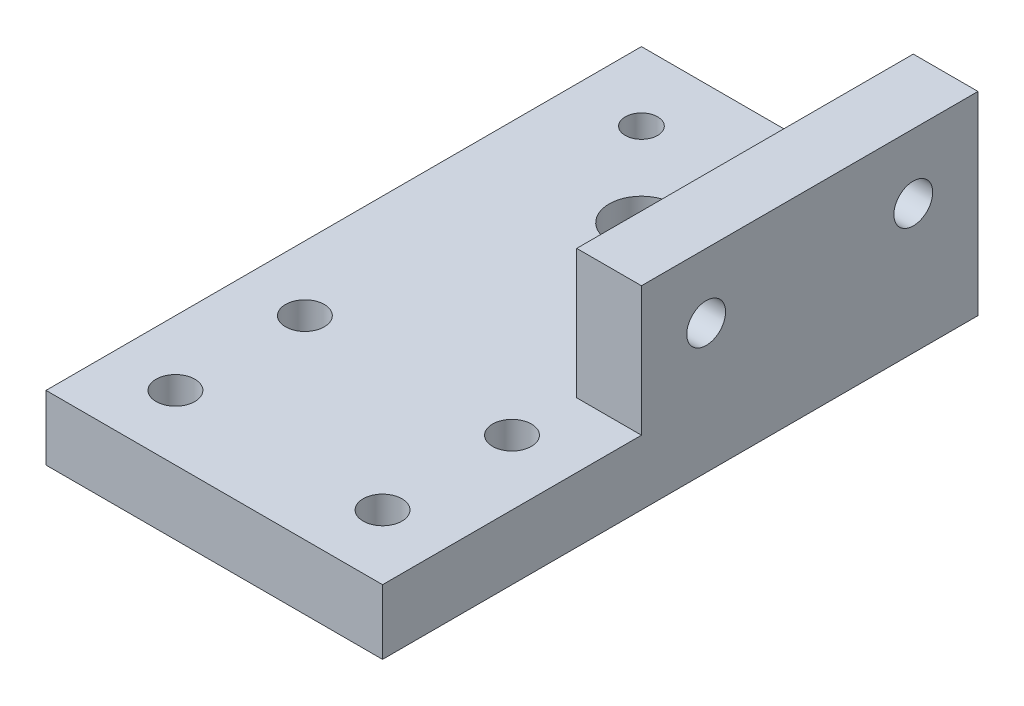
from build123d import *

# Parameters (mm, degrees)
SKETCH1_W           = 52
SKETCH1_H           = 92
BOSS_EXTRUDE1_DEPTH = 10
SKETCH2_W           = 10
SKETCH2_H           = 52
BOSS_EXTRUDE3_DEPTH = 20
CUT_EXTRUDE3_REACH  = 109.555
SKETCH5_R           = 3
SKETCH5_R_2         = 5
SKETCH5_R_3         = 2.5
CUT_EXTRUDE4_REACH  = 107.489
SKETCH6_R           = 3


with BuildPart() as part:
    # Sketch1 → Boss-Extrude1 (new body)
    with BuildSketch(Plane(origin=(0, 0, 0), x_dir=(1, 0, 0), z_dir=(0, 1, 0))):
        with Locations((26, 46)):
            Rectangle(SKETCH1_W, SKETCH1_H)
    extrude(amount=BOSS_EXTRUDE1_DEPTH)

    # Sketch2 → Boss-Extrude3 (add)
    with BuildSketch(Plane(origin=(0, 10, 0), x_dir=(1, 0, 0), z_dir=(0, 1, 0))):
        with Locations((47, 66)):
            Rectangle(SKETCH2_W, SKETCH2_H)
    extrude(amount=BOSS_EXTRUDE3_DEPTH)

    # Sketch5 → Cut-Extrude3 (cut, up to next)
    with BuildSketch(Plane(origin=(0, 10, 0), x_dir=(1, 0, 0), z_dir=(0, 1, 0)), mode=Mode.PRIVATE) as cut_extrude3_sk1:
        with Locations(Location((10, 30, 0), (0, 0, 270))):
            Circle(SKETCH5_R)
    cut_extrude3_tool1 = extrude(cut_extrude3_sk1.sketch, amount=-CUT_EXTRUDE3_REACH, mode=Mode.PRIVATE) & part.part
    # Sketch5 → Cut-Extrude3 (cut, up to next)
    with BuildSketch(Plane(origin=(0, 10, 0), x_dir=(1, 0, 0), z_dir=(0, 1, 0)), mode=Mode.PRIVATE) as cut_extrude3_sk2:
        with Locations(Location((42, 30, 0), (0, 0, 270))):
            Circle(SKETCH5_R)
    cut_extrude3_tool2 = extrude(cut_extrude3_sk2.sketch, amount=-CUT_EXTRUDE3_REACH, mode=Mode.PRIVATE) & part.part
    # Sketch5 → Cut-Extrude3 (cut, up to next)
    with BuildSketch(Plane(origin=(0, 10, 0), x_dir=(1, 0, 0), z_dir=(0, 1, 0)), mode=Mode.PRIVATE) as cut_extrude3_sk3:
        with Locations(Location((10, 10, 0), (0, 0, 270))):
            Circle(SKETCH5_R)
    cut_extrude3_tool3 = extrude(cut_extrude3_sk3.sketch, amount=-CUT_EXTRUDE3_REACH, mode=Mode.PRIVATE) & part.part
    # Sketch5 → Cut-Extrude3 (cut, up to next)
    with BuildSketch(Plane(origin=(0, 10, 0), x_dir=(1, 0, 0), z_dir=(0, 1, 0)), mode=Mode.PRIVATE) as cut_extrude3_sk4:
        with Locations(Location((42, 10, 0), (0, 0, 270))):
            Circle(SKETCH5_R)
    cut_extrude3_tool4 = extrude(cut_extrude3_sk4.sketch, amount=-CUT_EXTRUDE3_REACH, mode=Mode.PRIVATE) & part.part
    # Sketch5 → Cut-Extrude3 (cut, up to next)
    with BuildSketch(Plane(origin=(0, 10, 0), x_dir=(1, 0, 0), z_dir=(0, 1, 0)), mode=Mode.PRIVATE) as cut_extrude3_sk5:
        with Locations(Location((23.55, 68.45, 0), (0, 0, 270))):
            Circle(SKETCH5_R_2)
    cut_extrude3_tool5 = extrude(cut_extrude3_sk5.sketch, amount=-CUT_EXTRUDE3_REACH, mode=Mode.PRIVATE) & part.part
    # Sketch5 → Cut-Extrude3 (cut, up to next)
    with BuildSketch(Plane(origin=(0, 10, 0), x_dir=(1, 0, 0), z_dir=(0, 1, 0)), mode=Mode.PRIVATE) as cut_extrude3_sk6:
        with Locations(Location((10.645301243, 81.354698757, 0), (0, 0, 270))):
            Circle(SKETCH5_R_3)
    cut_extrude3_tool6 = extrude(cut_extrude3_sk6.sketch, amount=-CUT_EXTRUDE3_REACH, mode=Mode.PRIVATE) & part.part
    # Sketch5 → Cut-Extrude3 (cut, up to next)
    with BuildSketch(Plane(origin=(0, 10, 0), x_dir=(1, 0, 0), z_dir=(0, 1, 0)), mode=Mode.PRIVATE) as cut_extrude3_sk7:
        with Locations(Location((36.454698757, 55.545301243, 0), (0, 0, 270))):
            Circle(SKETCH5_R_3)
    cut_extrude3_tool7 = extrude(cut_extrude3_sk7.sketch, amount=-CUT_EXTRUDE3_REACH, mode=Mode.PRIVATE) & part.part
    add(cut_extrude3_tool1.solids().sort_by_distance((10, 10, -30))[0], mode=Mode.SUBTRACT)
    add(cut_extrude3_tool2.solids().sort_by_distance((42, 10, -30))[0], mode=Mode.SUBTRACT)
    add(cut_extrude3_tool3.solids().sort_by_distance((10, 10, -10))[0], mode=Mode.SUBTRACT)
    add(cut_extrude3_tool4.solids().sort_by_distance((42, 10, -10))[0], mode=Mode.SUBTRACT)
    add(cut_extrude3_tool5.solids().sort_by_distance((23.55, 10, -68.45))[0], mode=Mode.SUBTRACT)
    add(cut_extrude3_tool6.solids().sort_by_distance((10.645301, 10, -81.354699))[0], mode=Mode.SUBTRACT)
    add(cut_extrude3_tool7.solids().sort_by_distance((36.454699, 10, -55.545301))[0], mode=Mode.SUBTRACT)

    # Sketch6 → Cut-Extrude4 (cut, up to next)
    with BuildSketch(Plane.ZY.offset(-42), mode=Mode.PRIVATE) as cut_extrude4_sk1:
        with Locations((-50, 20.01)):
            Circle(SKETCH6_R)
    cut_extrude4_tool1 = extrude(cut_extrude4_sk1.sketch, amount=-CUT_EXTRUDE4_REACH, mode=Mode.PRIVATE) & part.part
    # Sketch6 → Cut-Extrude4 (cut, up to next)
    with BuildSketch(Plane.ZY.offset(-42), mode=Mode.PRIVATE) as cut_extrude4_sk2:
        with Locations((-82, 20.01)):
            Circle(SKETCH6_R)
    cut_extrude4_tool2 = extrude(cut_extrude4_sk2.sketch, amount=-CUT_EXTRUDE4_REACH, mode=Mode.PRIVATE) & part.part
    add(cut_extrude4_tool1.solids().sort_by_distance((42, 20.01, -50))[0], mode=Mode.SUBTRACT)
    add(cut_extrude4_tool2.solids().sort_by_distance((42, 20.01, -82))[0], mode=Mode.SUBTRACT)


solid = part.part
